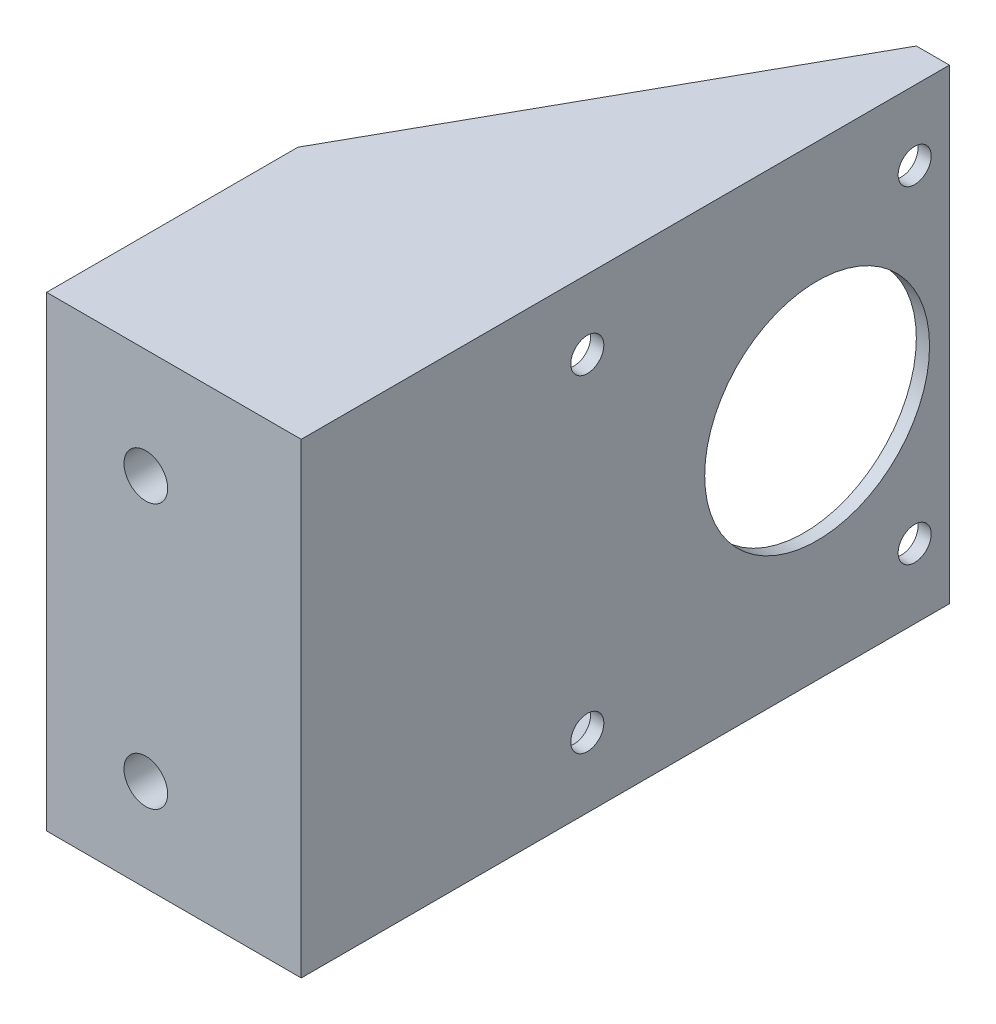
from build123d import *

# Parameters (mm, degrees)
SKETCH1_W                                       = 38.5
SKETCH1_H                                       = 70.536099416
BOSS_EXTRUDE1_DEPTH                             = 38
BOSS_EXTRUDE2_DEPTH                             = 4
BOSS_EXTRUDE3_START                             = -70.536099
BOSS_EXTRUDE3_DEPTH                             = 4
SKETCH4_W                                       = 62.536099416
SKETCH4_H                                       = 60
SKETCH4_R                                       = 17
SKETCH4_R_2                                     = 2.5
BOSS_EXTRUDE4_DEPTH                             = 2
CSK_FOR_M6_FLAT_HEAD_MACHINE_SCREW1_D           = 6.6
CSK_FOR_M6_FLAT_HEAD_MACHINE_SCREW1_CSINK_D     = 12.6
CSK_FOR_M6_FLAT_HEAD_MACHINE_SCREW1_CSINK_ANGLE = 90


with BuildPart() as part:
    # Sketch1 → Boss-Extrude1 (new body)
    with BuildSketch(Plane(origin=(0, 0, 502.500831462), x_dir=(1, 0, 0), z_dir=(0, 0, -1))):
        with Locations((165.241839146, 0)):
            Rectangle(SKETCH1_W, SKETCH1_H)
    extrude(amount=BOSS_EXTRUDE1_DEPTH)

    # Sketch3 → Boss-Extrude2 (add)
    with BuildSketch(Plane(origin=(0, 35.268049708, 0), x_dir=(-1, 0, 0), z_dir=(0, 1, 0))):
        Polygon((-184.491839146, 404.500831462), (-179.491839146, 404.500831462), (-145.991839146, 464.500831462), (-184.491839146, 464.500831462), align=None)
    extrude(amount=-BOSS_EXTRUDE2_DEPTH)

    # Sketch3<2> → Boss-Extrude3 (add)
    with BuildSketch(Plane(origin=(0, 35.268049708, 0), x_dir=(-1, 0, 0), z_dir=(0, 1, 0)).offset(BOSS_EXTRUDE3_START)):
        Polygon((-184.491839146, 404.500831462), (-179.491839146, 404.500831462), (-145.991839146, 464.500831462), (-184.491839146, 464.500831462), align=None)
    extrude(amount=BOSS_EXTRUDE3_DEPTH)

    # Sketch4 → Boss-Extrude4 (add)
    with BuildSketch(Plane.YZ.offset(184.491839146)):
        with Locations((0, 434.500831462)):
            Rectangle(SKETCH4_W, SKETCH4_H)
        with Locations(Location((0, 424.500831462, 0), (0, 0, 270))):
            Circle(SKETCH4_R, mode=Mode.SUBTRACT)
        with Locations(Location((-24.75, 459.250831462, 0), (0, 0, 270))):
            Circle(SKETCH4_R_2, mode=Mode.SUBTRACT)
        with Locations(Location((24.75, 459.250831462, 0), (0, 0, 270))):
            Circle(SKETCH4_R_2, mode=Mode.SUBTRACT)
        with Locations(Location((24.75, 409.750831462, 0), (0, 0, 270))):
            Circle(SKETCH4_R_2, mode=Mode.SUBTRACT)
        with Locations(Location((-24.75, 409.750831462, 0), (0, 0, 270))):
            Circle(SKETCH4_R_2, mode=Mode.SUBTRACT)
    extrude(amount=-BOSS_EXTRUDE4_DEPTH)

    # CSK for M6 Flat Head Machine Screw1 (through all)
    with Locations(Plane(origin=(0, 0, 464.500831462), x_dir=(1, 0, 0), z_dir=(0, 0, -1))):
        with Locations((160.991839146, -18.731950292), (160.991839146, 21.268049708)):
            CounterSinkHole(CSK_FOR_M6_FLAT_HEAD_MACHINE_SCREW1_D / 2, CSK_FOR_M6_FLAT_HEAD_MACHINE_SCREW1_CSINK_D / 2, counter_sink_angle=CSK_FOR_M6_FLAT_HEAD_MACHINE_SCREW1_CSINK_ANGLE)


solid = part.part
